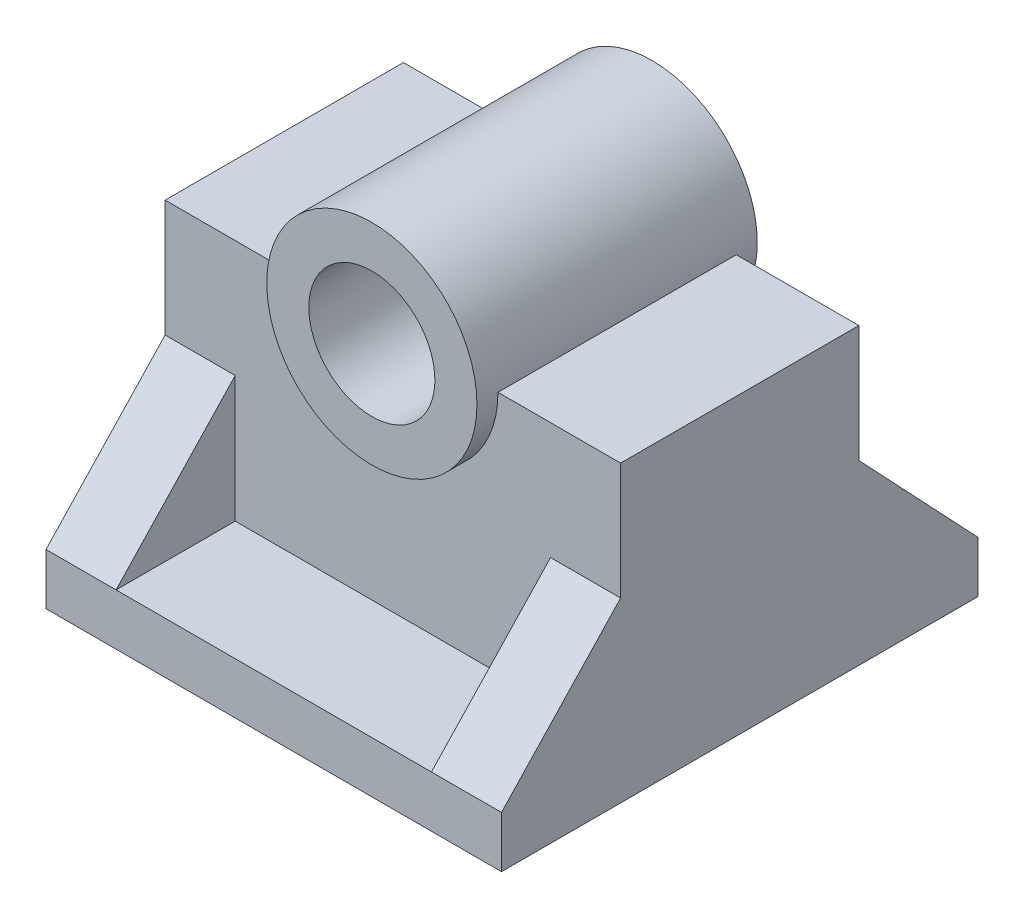
from build123d import *

# Parameters (mm, degrees)
BOSS_EXTRUDE1_DEPTH = 65
BOSS_EXTRUDE2_DEPTH = 10
BOSS_EXTRUDE3_DEPTH = 10
BOSS_EXTRUDE4_DEPTH = 10
BOSS_EXTRUDE5_DEPTH = 10
SKETCH6_R           = 15
BOSS_EXTRUDE6_DEPTH = 34
BOSS_EXTRUDE7_START = 3
SKETCH7_R           = 15
BOSS_EXTRUDE7_DEPTH = 3
SKETCH8_R           = 15
BOSS_EXTRUDE8_DEPTH = 3
CUT_EXTRUDE1_REACH  = 98.743
SKETCH9_R           = 9


with BuildPart() as part:
    # Sketch1 → Boss-Extrude1 (new body)
    with BuildSketch(Plane(origin=(0, 0, 0), x_dir=(0, 0, -1), z_dir=(1, 0, 0))):
        Polygon((-50.255892256, -9.902356902), (-50.255892256, -2.575757576), (-33.255892256, -2.575757576), (-33.255892256, 32.097643098), (0.744107744, 32.097643098), (0.744107744, -2.575757576), (17.744107744, -2.575757576), (17.744107744, -9.902356902), align=None)
    extrude(amount=-BOSS_EXTRUDE1_DEPTH)

    # Sketch2 → Boss-Extrude2 (add)
    with BuildSketch(Plane(origin=(0, 0, 0), x_dir=(0, 0, -1), z_dir=(1, 0, 0))):
        Polygon((-33.255892256, 15.424242424), (-50.255892256, -2.575757576), (-33.255892256, -2.575757576), align=None)
    extrude(amount=-BOSS_EXTRUDE2_DEPTH)

    # Sketch3 → Boss-Extrude3 (add)
    with BuildSketch(Plane.ZY.offset(65)):
        Polygon((33.255892256, 15.424242424), (50.255892256, -2.575757576), (33.255892256, -2.575757576), align=None)
    extrude(amount=-BOSS_EXTRUDE3_DEPTH)

    # Sketch4 → Boss-Extrude4 (add)
    with BuildSketch(Plane.ZY.offset(65)):
        Polygon((-17.744107744, -2.575757576), (-0.744107744, 15.424242424), (-0.744107744, -2.575757576), align=None)
    extrude(amount=-BOSS_EXTRUDE4_DEPTH)

    # Sketch5 → Boss-Extrude5 (add)
    with BuildSketch(Plane(origin=(0, 0, 0), x_dir=(0, 0, -1), z_dir=(1, 0, 0))):
        Polygon((0.744107744, 15.424242424), (17.744107744, -2.575757576), (0.744107744, -2.575757576), align=None)
    extrude(amount=-BOSS_EXTRUDE5_DEPTH)

    # Sketch6 → Boss-Extrude6 (add)
    with BuildSketch(Plane.XY.offset(33.255892256)):
        with Locations((-32.5, 32.097643098)):
            Circle(SKETCH6_R)
    extrude(amount=-BOSS_EXTRUDE6_DEPTH)

    # Sketch7 → Boss-Extrude7 (add)
    with BuildSketch(Plane.XY.offset(33.255892256).offset(BOSS_EXTRUDE7_START)):
        with Locations((-32.5, 32.097643098)):
            Circle(SKETCH7_R)
    extrude(amount=-BOSS_EXTRUDE7_DEPTH)

    # Sketch8 → Boss-Extrude8 (add)
    with BuildSketch(Plane(origin=(0, 0, -0.744107744), x_dir=(-1, 0, 0), z_dir=(0, 0, -1))):
        with Locations(Location((32.5, 32.097643098, 0), (0, 0, 180))):
            Circle(SKETCH8_R)
    extrude(amount=BOSS_EXTRUDE8_DEPTH)

    # Sketch9 → Cut-Extrude1 (cut, up to next)
    with BuildSketch(Plane(origin=(0, 0, -3.744107744), x_dir=(-1, 0, 0), z_dir=(0, 0, -1)), mode=Mode.PRIVATE) as cut_extrude1_sk1:
        with Locations(Location((32.5, 32.097643098, 0), (0, 0, 90))):
            Circle(SKETCH9_R)
    cut_extrude1_tool1 = extrude(cut_extrude1_sk1.sketch, amount=-CUT_EXTRUDE1_REACH, mode=Mode.PRIVATE) & part.part
    add(cut_extrude1_tool1.solids().sort_by_distance((-32.5, 32.097643, -3.744108))[0], mode=Mode.SUBTRACT)


solid = part.part
